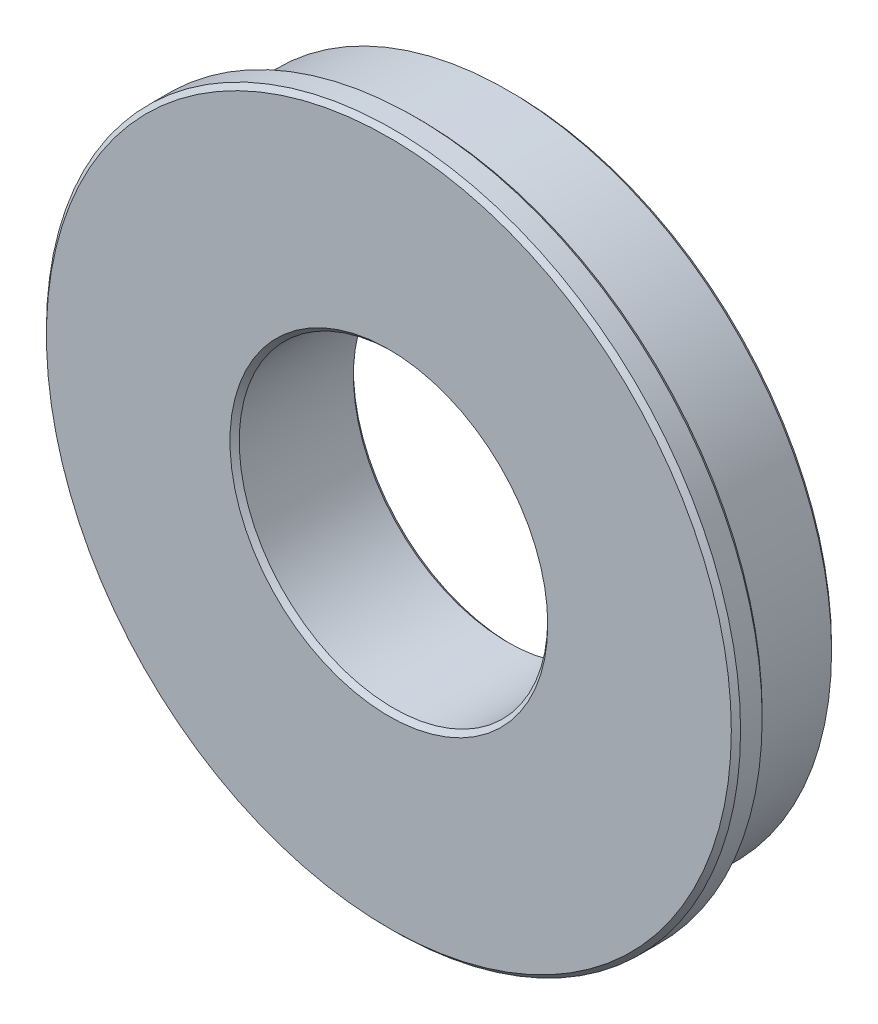
from build123d import *

# Parameters (mm, degrees)
SKETCH_1_R      = 21
SKETCH_1_R_2    = 10
EXTRUDE_1_DEPTH = 4
EXTRUDE_START   = -2
SKETCH_2_R      = 22.5
SKETCH_2_R_2    = 10
EXTRUDE_2_DEPTH = 2
CHAMFER_1_SIZE  = 0.3


with BuildPart() as part:
    # 草图1 → 凸台-拉伸1 (new, symmetric)
    with BuildSketch(Plane.XY):
        Circle(SKETCH_1_R)
        Circle(SKETCH_1_R_2, mode=Mode.SUBTRACT)
    extrude(amount=EXTRUDE_1_DEPTH, both=True)

    # 草图2 → 凸台-拉伸2 (add)
    with BuildSketch(Plane.XY.offset(4).offset(EXTRUDE_START)):
        Circle(SKETCH_2_R)
        Circle(SKETCH_2_R_2, mode=Mode.SUBTRACT)
    extrude(amount=EXTRUDE_2_DEPTH)

    # 倒角1
    chamfer_1_edges = [part.edges().sort_by_distance(p)[0] for p in [
        (-22.5, 0, 4),
        (-22.5, 0, 2),
        (-21, 0, -4),
        (-10, 0, -4),
        (-10, 0, 4),
    ]]
    chamfer(chamfer_1_edges, length=CHAMFER_1_SIZE)


solid = part.part
